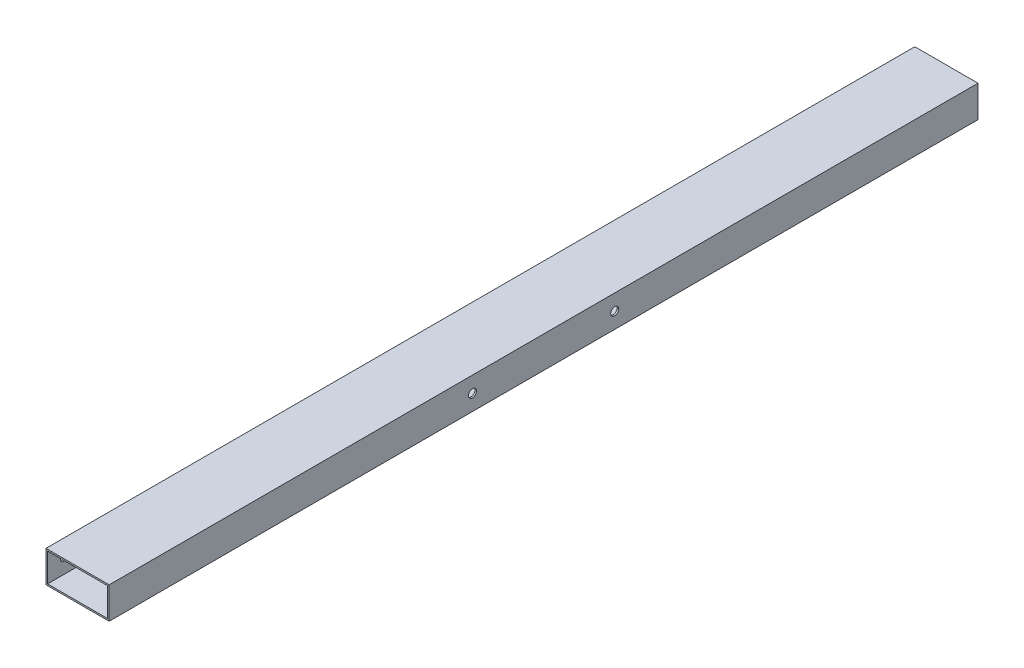
from build123d import *

# Parameters (mm, degrees)
SKETCH_1_W          = 40
SKETCH_1_H          = 20
SKETCH_1_W_2        = 38
SKETCH_1_H_2        = 18
EXTRUDE_1_DEPTH     = 550
SKETCH_4_R          = 1.75
CUT_EXTRUDE_2_DEPTH = 1.5
SKETCH_5_R          = 2.6
CUT_EXTRUDE_3_DEPTH = 1.5
SKETCH_6_R          = 2.5
CUT_EXTRUDE_4_DEPTH = 552.815186453


with BuildPart() as part:
    # 草图1 → 拉伸-薄壁1 (new body)
    with BuildSketch(Plane.XY):
        with Locations((20, -10)):
            Rectangle(SKETCH_1_W, SKETCH_1_H)
        with Locations((20, -10)):
            Rectangle(SKETCH_1_W_2, SKETCH_1_H_2, mode=Mode.SUBTRACT)
    extrude(amount=EXTRUDE_1_DEPTH)

    # 草图4 → 切除-拉伸2 (cut)
    with BuildSketch(Plane.ZY):
        with Locations((539.996387591, -10)):
            Circle(SKETCH_4_R)
        with Locations((10, -10.000000002)):
            Circle(SKETCH_4_R)
    extrude(amount=-CUT_EXTRUDE_2_DEPTH, mode=Mode.SUBTRACT)

    # 草图5 → 切除-拉伸3 (cut)
    with BuildSketch(Plane.ZY):
        with Locations((255, -10)):
            Circle(SKETCH_5_R)
    extrude(amount=-CUT_EXTRUDE_3_DEPTH, mode=Mode.SUBTRACT)

    # 草图6 → 切除-拉伸4 (cut, through all)
    with BuildSketch(Plane(origin=(40, 0, 0), x_dir=(0, 0, -1), z_dir=(1, 0, 0))):
        with Locations((-320, -10)):
            Circle(SKETCH_6_R)
        with Locations((-230, -10)):
            Circle(SKETCH_6_R)
    extrude(amount=-CUT_EXTRUDE_4_DEPTH, mode=Mode.SUBTRACT)


solid = part.part
